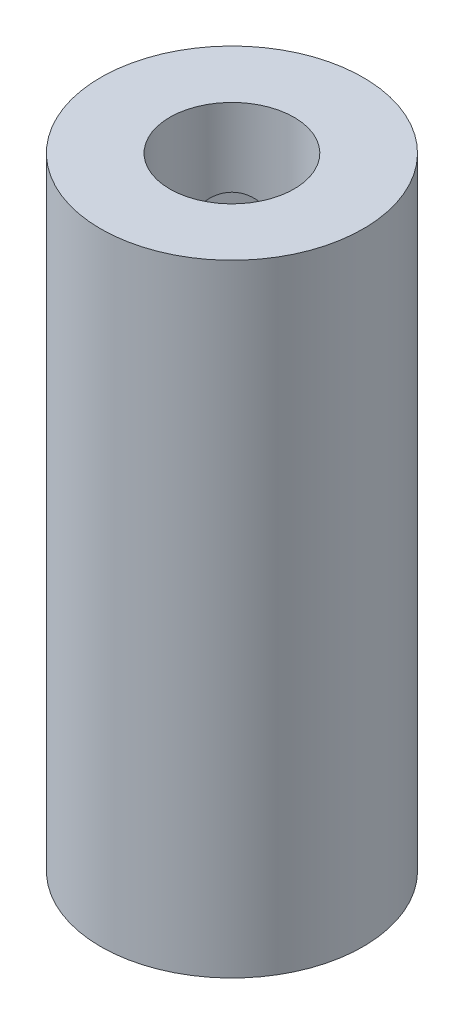
from build123d import *

# Parameters (mm, degrees)
SKETCH1_R                    = 48.26
BOSS_EXTRUDE1_DEPTH          = 228.6
SHELL1_T                     = -25.4
SKETCH4_R                    = 12.7
CUT_EXTRUDE9_DEPTH           = 45.72
LPATTERN1_COUNT              = 5
LPATTERN1_PITCH              = 37.300000076
CIRPATTERN1_COPY_1_SKETCH_R  = 12.7
CIRPATTERN1_COPY_1_DEPTH     = 45.72
CIRPATTERN1_COPY_2_SKETCH_R  = 12.7
CIRPATTERN1_COPY_2_DEPTH     = 45.72
CIRPATTERN1_COPY_3_SKETCH_R  = 12.7
CIRPATTERN1_COPY_3_DEPTH     = 45.72
CIRPATTERN1_COPY_4_SKETCH_R  = 12.7
CIRPATTERN1_COPY_4_DEPTH     = 45.72
CIRPATTERN1_COPY_5_SKETCH_R  = 12.7
CIRPATTERN1_COPY_5_DEPTH     = 45.72
CIRPATTERN1_COPY_6_SKETCH_R  = 12.7
CIRPATTERN1_COPY_6_DEPTH     = 45.72
CIRPATTERN1_COPY_7_SKETCH_R  = 12.7
CIRPATTERN1_COPY_7_DEPTH     = 45.72
CIRPATTERN1_COPY_8_SKETCH_R  = 12.7
CIRPATTERN1_COPY_8_DEPTH     = 45.72
CIRPATTERN1_COPY_9_SKETCH_R  = 12.7
CIRPATTERN1_COPY_9_DEPTH     = 45.72
CIRPATTERN1_COPY_10_SKETCH_R = 12.7
CIRPATTERN1_COPY_10_DEPTH    = 45.72
CIRPATTERN1_COPY_11_SKETCH_R = 12.7
CIRPATTERN1_COPY_11_DEPTH    = 45.72
CIRPATTERN1_COPY_12_SKETCH_R = 12.7
CIRPATTERN1_COPY_12_DEPTH    = 45.72
CIRPATTERN1_COPY_13_SKETCH_R = 12.7
CIRPATTERN1_COPY_13_DEPTH    = 45.72
CIRPATTERN1_COPY_14_SKETCH_R = 12.7
CIRPATTERN1_COPY_14_DEPTH    = 45.72
CIRPATTERN1_COPY_15_SKETCH_R = 12.7
CIRPATTERN1_COPY_15_DEPTH    = 45.72


with BuildPart() as part:
    # Sketch1 → Boss-Extrude1 (new body)
    with BuildSketch(Plane(origin=(0, 0, 0), x_dir=(1, 0, 0), z_dir=(0, 1, 0))):
        Circle(SKETCH1_R)
    extrude(amount=BOSS_EXTRUDE1_DEPTH)

    # Shell1
    shell1_openings = [part.faces().sort_by_distance(p)[0] for p in [
        (0, 228.6, 0),
    ]]
    offset(amount=SHELL1_T, openings=shell1_openings, kind=Kind.INTERSECTION)

    # Sketch4 → Cut-Extrude9 (cut, symmetric)
    with BuildSketch(Plane.XY):
        with Locations((0, 38.1)):
            Circle(SKETCH4_R)
    cut_extrude9 = extrude(amount=CUT_EXTRUDE9_DEPTH, both=True, mode=Mode.SUBTRACT)

    # LPattern1: Cut-Extrude9 ×5
    with Locations(*[(0, i * LPATTERN1_PITCH, 0) for i in range(1, LPATTERN1_COUNT)]):
        add(cut_extrude9, mode=Mode.SUBTRACT)

    # CirPattern1 copy 1 sketch → CirPattern1 copy 1 (cut, symmetric)
    with BuildSketch(Plane(origin=(0, 37.300000076, 0), x_dir=(0.7071067811865464, 0, 0.7071067811865487), z_dir=(-0.7071067811865487, 0, 0.7071067811865464))):
        with Locations((0, 38.1)):
            Circle(CIRPATTERN1_COPY_1_SKETCH_R)
    extrude(amount=CIRPATTERN1_COPY_1_DEPTH, both=True, mode=Mode.SUBTRACT)

    # CirPattern1 copy 2 sketch → CirPattern1 copy 2 (cut, symmetric)
    with BuildSketch(Plane(origin=(0, 37.300000076, 0), x_dir=(0, 0, 1), z_dir=(-1, 0, 0))):
        with Locations((0, 38.1)):
            Circle(CIRPATTERN1_COPY_2_SKETCH_R)
    extrude(amount=CIRPATTERN1_COPY_2_DEPTH, both=True, mode=Mode.SUBTRACT)

    # CirPattern1 copy 3 sketch → CirPattern1 copy 3 (cut, symmetric)
    with BuildSketch(Plane(origin=(0, 37.300000076, 0), x_dir=(-0.7071067811865509, 0, 0.7071067811865441), z_dir=(-0.7071067811865441, 0, -0.7071067811865509))):
        with Locations((0, 38.1)):
            Circle(CIRPATTERN1_COPY_3_SKETCH_R)
    extrude(amount=CIRPATTERN1_COPY_3_DEPTH, both=True, mode=Mode.SUBTRACT)

    # CirPattern1 copy 4 sketch → CirPattern1 copy 4 (cut, symmetric)
    with BuildSketch(Plane(origin=(0, 74.600000152, 0), x_dir=(0.7071067811865464, 0, 0.7071067811865487), z_dir=(-0.7071067811865487, 0, 0.7071067811865464))):
        with Locations((0, 38.1)):
            Circle(CIRPATTERN1_COPY_4_SKETCH_R)
    extrude(amount=CIRPATTERN1_COPY_4_DEPTH, both=True, mode=Mode.SUBTRACT)

    # CirPattern1 copy 5 sketch → CirPattern1 copy 5 (cut, symmetric)
    with BuildSketch(Plane(origin=(0, 74.600000152, 0), x_dir=(0, 0, 1), z_dir=(-1, 0, 0))):
        with Locations((0, 38.1)):
            Circle(CIRPATTERN1_COPY_5_SKETCH_R)
    extrude(amount=CIRPATTERN1_COPY_5_DEPTH, both=True, mode=Mode.SUBTRACT)

    # CirPattern1 copy 6 sketch → CirPattern1 copy 6 (cut, symmetric)
    with BuildSketch(Plane(origin=(0, 74.600000152, 0), x_dir=(-0.7071067811865509, 0, 0.7071067811865441), z_dir=(-0.7071067811865441, 0, -0.7071067811865509))):
        with Locations((0, 38.1)):
            Circle(CIRPATTERN1_COPY_6_SKETCH_R)
    extrude(amount=CIRPATTERN1_COPY_6_DEPTH, both=True, mode=Mode.SUBTRACT)

    # CirPattern1 copy 7 sketch → CirPattern1 copy 7 (cut, symmetric)
    with BuildSketch(Plane(origin=(0, 111.900000228, 0), x_dir=(0.7071067811865464, 0, 0.7071067811865487), z_dir=(-0.7071067811865487, 0, 0.7071067811865464))):
        with Locations((0, 38.1)):
            Circle(CIRPATTERN1_COPY_7_SKETCH_R)
    extrude(amount=CIRPATTERN1_COPY_7_DEPTH, both=True, mode=Mode.SUBTRACT)

    # CirPattern1 copy 8 sketch → CirPattern1 copy 8 (cut, symmetric)
    with BuildSketch(Plane(origin=(0, 111.900000228, 0), x_dir=(0, 0, 1), z_dir=(-1, 0, 0))):
        with Locations((0, 38.1)):
            Circle(CIRPATTERN1_COPY_8_SKETCH_R)
    extrude(amount=CIRPATTERN1_COPY_8_DEPTH, both=True, mode=Mode.SUBTRACT)

    # CirPattern1 copy 9 sketch → CirPattern1 copy 9 (cut, symmetric)
    with BuildSketch(Plane(origin=(0, 111.900000228, 0), x_dir=(-0.7071067811865509, 0, 0.7071067811865441), z_dir=(-0.7071067811865441, 0, -0.7071067811865509))):
        with Locations((0, 38.1)):
            Circle(CIRPATTERN1_COPY_9_SKETCH_R)
    extrude(amount=CIRPATTERN1_COPY_9_DEPTH, both=True, mode=Mode.SUBTRACT)

    # CirPattern1 copy 10 sketch → CirPattern1 copy 10 (cut, symmetric)
    with BuildSketch(Plane(origin=(0, 149.200000304, 0), x_dir=(0.7071067811865464, 0, 0.7071067811865487), z_dir=(-0.7071067811865487, 0, 0.7071067811865464))):
        with Locations((0, 38.1)):
            Circle(CIRPATTERN1_COPY_10_SKETCH_R)
    extrude(amount=CIRPATTERN1_COPY_10_DEPTH, both=True, mode=Mode.SUBTRACT)

    # CirPattern1 copy 11 sketch → CirPattern1 copy 11 (cut, symmetric)
    with BuildSketch(Plane(origin=(0, 149.200000304, 0), x_dir=(0, 0, 1), z_dir=(-1, 0, 0))):
        with Locations((0, 38.1)):
            Circle(CIRPATTERN1_COPY_11_SKETCH_R)
    extrude(amount=CIRPATTERN1_COPY_11_DEPTH, both=True, mode=Mode.SUBTRACT)

    # CirPattern1 copy 12 sketch → CirPattern1 copy 12 (cut, symmetric)
    with BuildSketch(Plane(origin=(0, 149.200000304, 0), x_dir=(-0.7071067811865509, 0, 0.7071067811865441), z_dir=(-0.7071067811865441, 0, -0.7071067811865509))):
        with Locations((0, 38.1)):
            Circle(CIRPATTERN1_COPY_12_SKETCH_R)
    extrude(amount=CIRPATTERN1_COPY_12_DEPTH, both=True, mode=Mode.SUBTRACT)

    # CirPattern1 copy 13 sketch → CirPattern1 copy 13 (cut, symmetric)
    with BuildSketch(Plane(origin=(0, 0, 0), x_dir=(0.7071067811865464, 0, 0.7071067811865487), z_dir=(-0.7071067811865487, 0, 0.7071067811865464))):
        with Locations((0, 38.1)):
            Circle(CIRPATTERN1_COPY_13_SKETCH_R)
    extrude(amount=CIRPATTERN1_COPY_13_DEPTH, both=True, mode=Mode.SUBTRACT)

    # CirPattern1 copy 14 sketch → CirPattern1 copy 14 (cut, symmetric)
    with BuildSketch(Plane.ZY):
        with Locations((0, 38.1)):
            Circle(CIRPATTERN1_COPY_14_SKETCH_R)
    extrude(amount=CIRPATTERN1_COPY_14_DEPTH, both=True, mode=Mode.SUBTRACT)

    # CirPattern1 copy 15 sketch → CirPattern1 copy 15 (cut, symmetric)
    with BuildSketch(Plane(origin=(0, 0, 0), x_dir=(-0.7071067811865509, 0, 0.7071067811865441), z_dir=(-0.7071067811865441, 0, -0.7071067811865509))):
        with Locations((0, 38.1)):
            Circle(CIRPATTERN1_COPY_15_SKETCH_R)
    extrude(amount=CIRPATTERN1_COPY_15_DEPTH, both=True, mode=Mode.SUBTRACT)


solid = part.part
